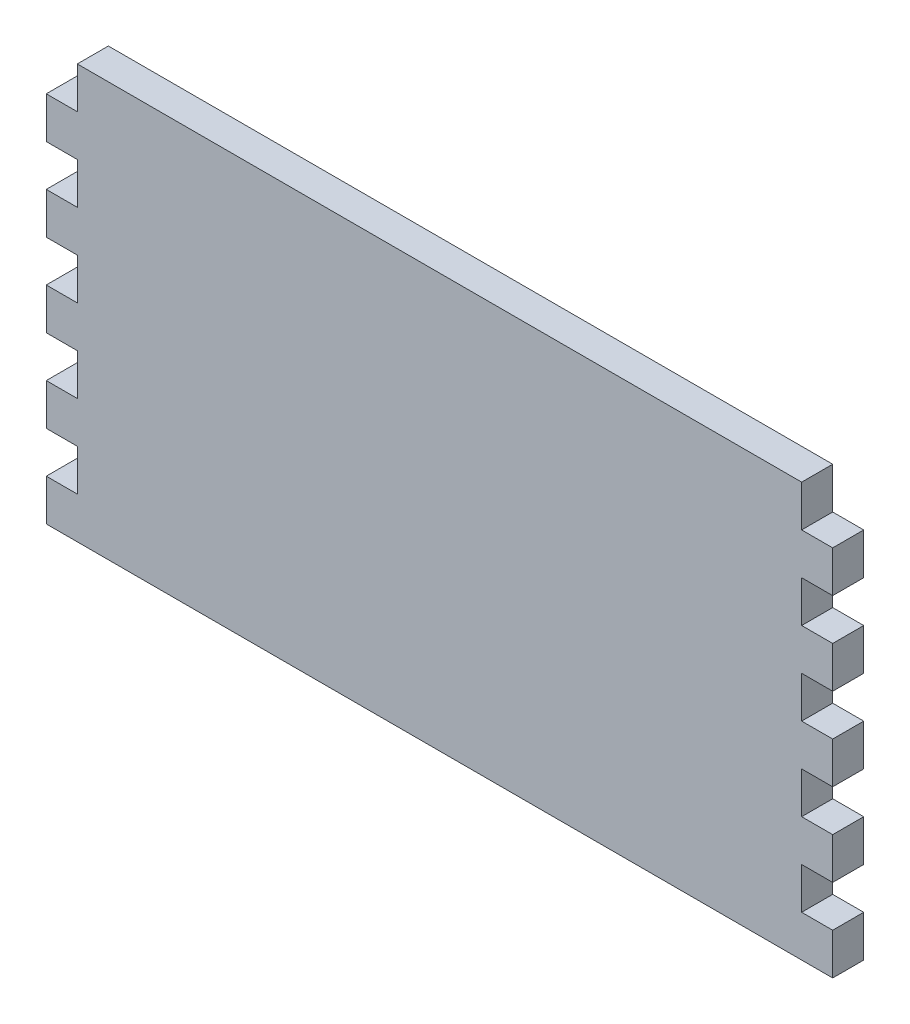
from build123d import *

# Parameters (mm, degrees)
BOSS_EXTRU_1_DEPTH = 3


with BuildPart() as part:
    # Esquisse1 → Boss.-Extru.1 (new body)
    with BuildSketch(Plane.XY):
        Polygon((-49.608259545, 25.410202795), (20.391740455, 25.410202795), (20.391740455, 21.410202795), (23.391740455, 21.410202795), (23.391740455, 17.410202795), (20.391740455, 17.410202795), (20.391740455, 13.410202795), (23.391740455, 13.410202795), (23.391740455, 9.410202795), (20.391740455, 9.410202795), (20.391740455, 5.410202795), (23.391740455, 5.410202795), (23.391740455, 1.410202795), (20.391740455, 1.410202795), (20.391740455, -2.589797205), (23.391740455, -2.589797205), (23.391740455, -6.589797205), (20.391740455, -6.589797205), (20.391740455, -10.589797205), (23.391740455, -10.589797205), (23.391740455, -14.589797205), (20.391740455, -14.589797205), (-49.608259545, -14.589797205), (-52.608259545, -14.589797205), (-52.608259545, -10.589797205), (-49.608259545, -10.589797205), (-49.608259545, -6.589797205), (-52.608259545, -6.589797205), (-52.608259545, -2.589797205), (-49.608259545, -2.589797205), (-49.608259545, 1.410202795), (-52.608259545, 1.410202795), (-52.608259545, 5.410202795), (-49.608259545, 5.410202795), (-49.608259545, 9.410202795), (-52.608259545, 9.410202795), (-52.608259545, 13.410202795), (-49.608259545, 13.410202795), (-49.608259545, 17.410202795), (-52.608259545, 17.410202795), (-52.608259545, 21.410202795), (-49.608259545, 21.410202795), align=None)
    extrude(amount=BOSS_EXTRU_1_DEPTH)


solid = part.part
